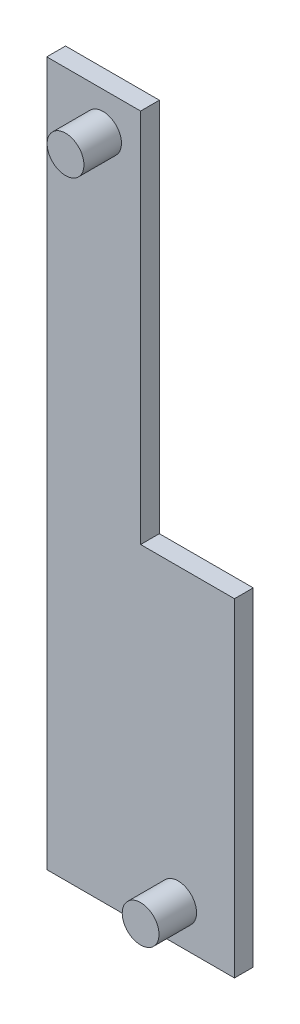
from build123d import *

# Parameters (mm, degrees)
SKETCH1_W           = 50
SKETCH1_H           = 187.5
BOSS_EXTRUDE1_DEPTH = 5
SKETCH2_R           = 4.9
BOSS_EXTRUDE2_DEPTH = 10
SKETCH3_W           = 25
SKETCH3_H           = 100
CUT_EXTRUDE1_DEPTH  = 10


with BuildPart() as part:
    # Sketch1 → Boss-Extrude1 (new body)
    with BuildSketch(Plane.XY):
        with Locations((25, 93.75)):
            Rectangle(SKETCH1_W, SKETCH1_H)
    extrude(amount=BOSS_EXTRUDE1_DEPTH)

    # Sketch2 → Boss-Extrude2 (add)
    with BuildSketch(Plane.XY.offset(5)):
        with Locations(Location((35, 10, 0), (0, 0, 180))):
            Circle(SKETCH2_R)
        with Locations(Location((15, 177.5, 0), (0, 0, 180))):
            Circle(SKETCH2_R)
    extrude(amount=BOSS_EXTRUDE2_DEPTH)

    # Sketch3 → Cut-Extrude1 (cut)
    with BuildSketch(Plane.XY.offset(5)):
        with Locations((37.5, 137.5)):
            Rectangle(SKETCH3_W, SKETCH3_H)
    extrude(amount=-CUT_EXTRUDE1_DEPTH, mode=Mode.SUBTRACT)


solid = part.part
